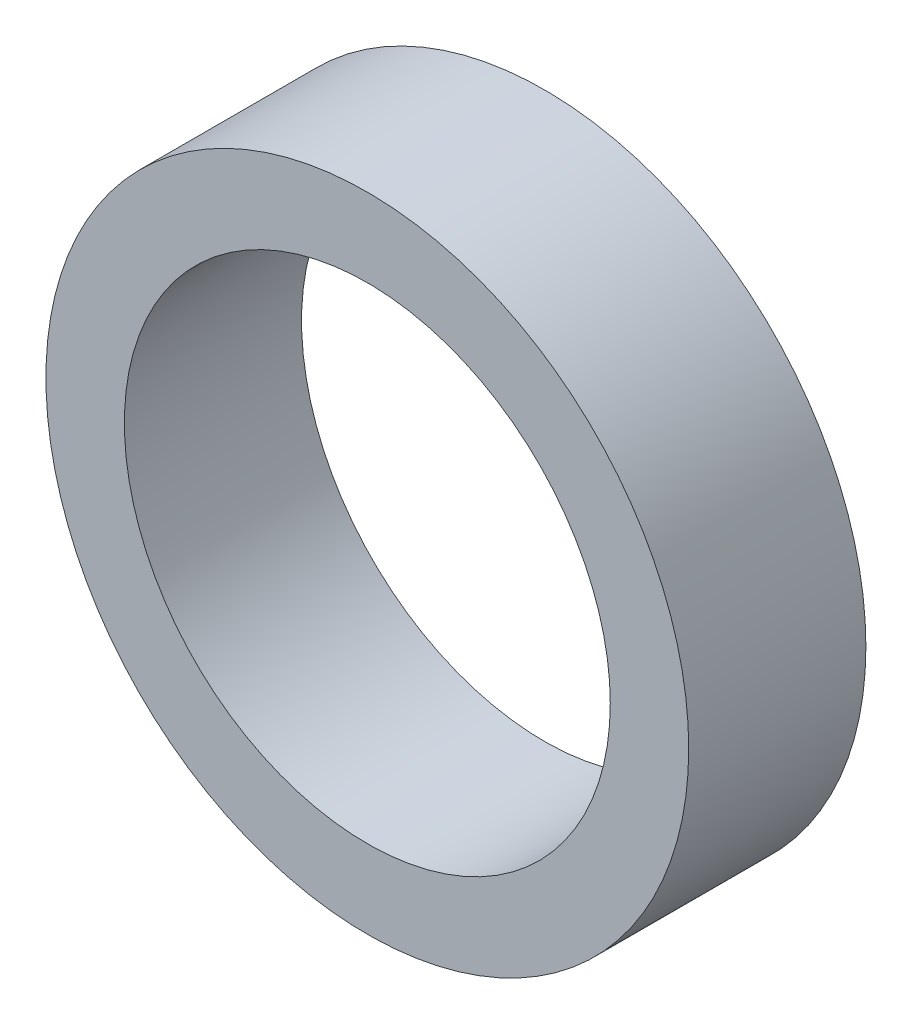
from build123d import *

# Parameters (mm, degrees)
TIRE_REFERENCE_START = -35
SKETCH_1_R           = 127
SKETCH_1_R_2         = 96
TIRE_REFERENCE_DEPTH = 70


with BuildPart() as part:
    # Эскиз1 → Tire_reference (new body)
    with BuildSketch(Plane.XY.offset(TIRE_REFERENCE_START)):
        Circle(SKETCH_1_R)
        Circle(SKETCH_1_R_2, mode=Mode.SUBTRACT)
    extrude(amount=TIRE_REFERENCE_DEPTH)


solid = part.part
